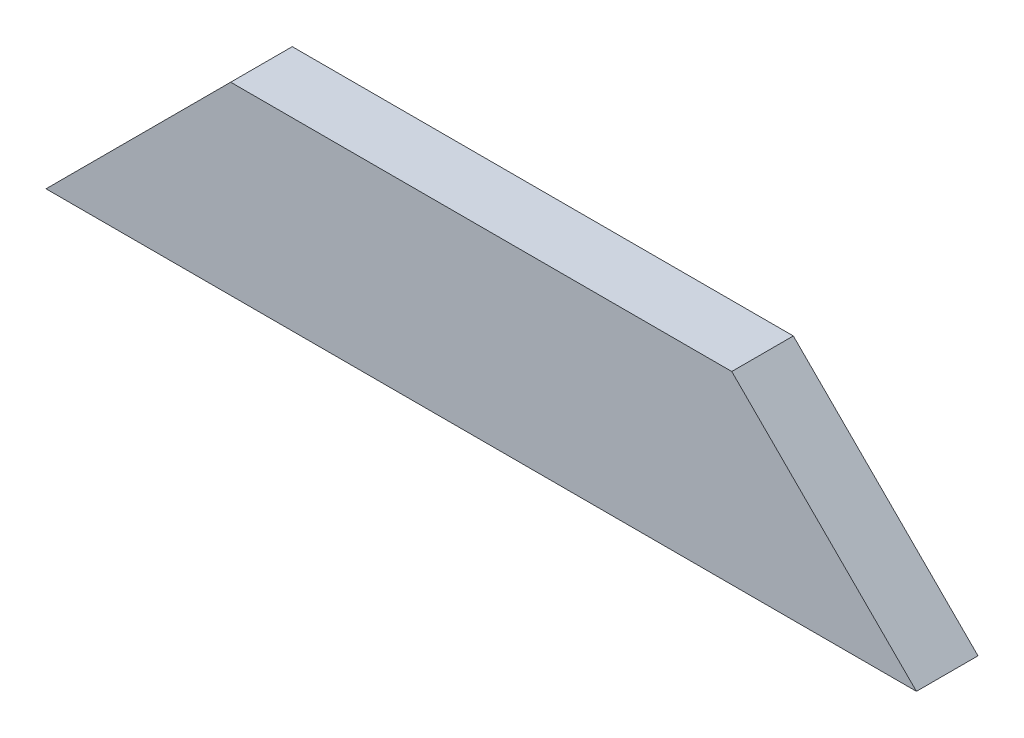
from build123d import *

# Parameters (mm, degrees)
BOSS_EXTRUDE3_DEPTH = 25


with BuildPart() as part:
    # Sketch2 → Boss-Extrude3 (new, symmetric)
    with BuildSketch(Plane.XY):
        Polygon((-353.5, -75), (-203.5, 75), (203.5, 75), (353.5, -75), align=None)
    extrude(amount=BOSS_EXTRUDE3_DEPTH, both=True)


solid = part.part
